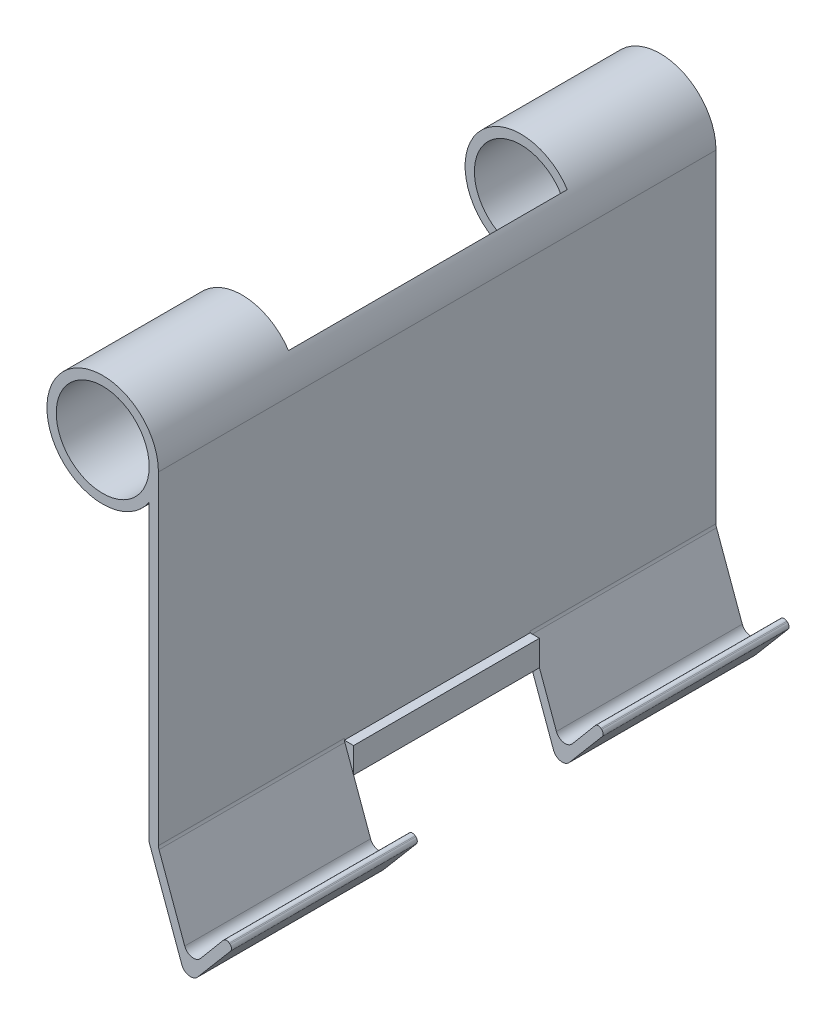
from build123d import *

# Parameters (mm, degrees)
SKETCH1_R           = 12.7
BOSS_EXTRUDE1_DEPTH = 152.4
CUT_EXTRUDE1_REACH  = 196.861
SKETCH2_W           = 50.8
SKETCH2_H           = 91.59656884
FILLET1_R           = 2.54
FILLET3_R           = 1.143
SKETCH4_W           = 76.2
SKETCH4_H           = 60.96
CUT_EXTRUDE3_DEPTH  = 38.1
SKETCH5_W           = 50.8
SKETCH5_H           = 6.992097594
BOSS_EXTRUDE2_DEPTH = 2.54


with BuildPart() as part:
    # Sketch1 → Boss-Extrude1 (new body)
    # profile 1 of 4: a face of its own
    with BuildSketch(Plane.XY):
        with BuildLine():
            Line((0, -8.424226968), (0, 0))
            Line((0, 0), (2.54, 0))
            ThreePointArc((2.54, 0), (-27.291189122, 4.399409051), (0, -8.424226968))
        make_face()
        with Locations(Location((-12.7, 0, 0), (0, 0, 180))):
            Circle(SKETCH1_R, mode=Mode.SUBTRACT)
    # profile 2 of 4: a face of its own
    with BuildSketch(Plane.XY):
        with BuildLine():
            Line((2.54, 0), (0, 0))
            Line((0, 0), (0, -8.424226968))
            ThreePointArc((0, -8.424226968), (1.891189122, -4.399409051), (2.54, 0))
        make_face()
    # profile 3 of 4: a face of its own
    with BuildSketch(Plane.XY):
        with BuildLine():
            ThreePointArc((2.54, 0), (1.891189122, -4.399409051), (0, -8.424226968))
            Line((0, -8.424226968), (0, -88.9))
            Line((0, -88.9), (2.54, -88.9))
            Line((2.54, -88.9), (2.54, 0))
        make_face()
    # profile 4 of 4: a face of its own
    with BuildSketch(Plane.XY):
        Polygon((22.969147698, -102.726355783), (10.424773969, -117.541831082), (0, -88.9), (2.54, -88.9), (11.22731164, -112.768192568), (21.023394812, -101.093675255), align=None)
    extrude(amount=BOSS_EXTRUDE1_DEPTH)

    # Sketch2 → Cut-Extrude1 (cut, up to next)
    with BuildSketch(Plane(origin=(2.54, 0, 0), x_dir=(0, 0, -1), z_dir=(1, 0, 0)), mode=Mode.PRIVATE) as cut_extrude1_sk1:
        with Locations((-76.2, -90.24828442)):
            Rectangle(SKETCH2_W, SKETCH2_H)
    cut_extrude1_tool1 = extrude(cut_extrude1_sk1.sketch, amount=CUT_EXTRUDE1_REACH, mode=Mode.PRIVATE) & part.part
    add(cut_extrude1_tool1.solids().sort_by_distance((2.54, -90.248284, 76.2))[0], mode=Mode.SUBTRACT)

    # Fillet1
    fillet1_edges = [part.edges().sort_by_distance(p)[0] for p in [
        (2.54, -88.9, 127),
        (11.22731164, -112.768192568, 127),
        (10.424773969, -117.541831082, 127),
        (2.54, -88.9, 25.4),
        (11.22731164, -112.768192568, 25.4),
        (10.424773969, -117.541831082, 25.4),
    ]]
    fillet(fillet1_edges, radius=FILLET1_R)

    # Fillet3
    fillet3_edges = [part.edges().sort_by_distance(p)[0] for p in [
        (21.023394812, -101.093675255, 127),
        (22.969147698, -102.726355783, 127),
        (21.023394812, -101.093675255, 25.4),
        (22.969147698, -102.726355783, 25.4),
    ]]
    fillet(fillet3_edges, radius=FILLET3_R)

    # Sketch4 → Cut-Extrude3 (cut)
    with BuildSketch(Plane.ZY):
        with Locations((76.2, 15.24)):
            Rectangle(SKETCH4_W, SKETCH4_H)
    extrude(amount=CUT_EXTRUDE3_DEPTH, mode=Mode.SUBTRACT)

    # Sketch5 → Boss-Extrude2 (add)
    with BuildSketch(Plane(origin=(2.54, 0, 0), x_dir=(0, 0, -1), z_dir=(1, 0, 0))):
        with Locations((-76.2, -92.382543848)):
            Rectangle(SKETCH5_W, SKETCH5_H)
    extrude(amount=BOSS_EXTRUDE2_DEPTH)


solid = part.part
